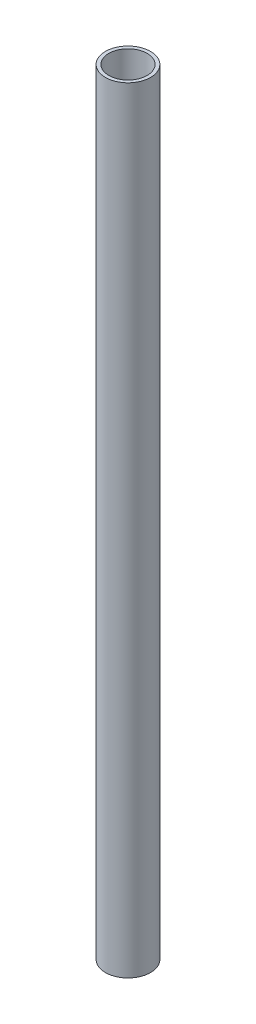
from build123d import *

# Parameters (mm, degrees)
SKETCH_1_R      = 16
SKETCH_1_R_2    = 13.6
EXTRUDE_1_DEPTH = 550


with BuildPart() as part:
    # 草图1 → 凸台-拉伸1 (new body)
    with BuildSketch(Plane(origin=(0, 0, 0), x_dir=(1, 0, 0), z_dir=(0, 1, 0))):
        with Locations(Location((0, 0, 0), (0, 0, 270))):
            Circle(SKETCH_1_R)
        with Locations(Location((0, 0, 0), (0, 0, 270))):
            Circle(SKETCH_1_R_2, mode=Mode.SUBTRACT)
    extrude(amount=EXTRUDE_1_DEPTH)


solid = part.part
